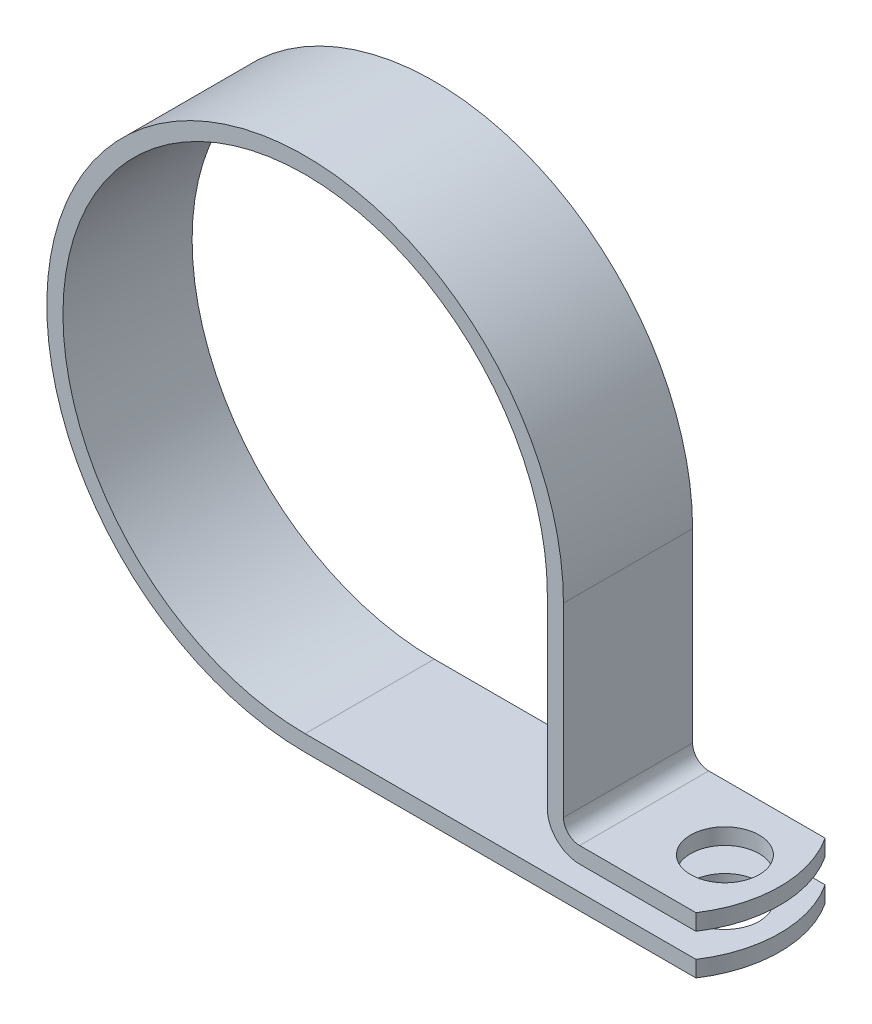
from build123d import *

# Parameters (mm, degrees)
BOSS_EXTRUDE1_DEPTH     = 6.35
SKETCH2_R               = 3.3734375
CUT_EXTRUDE1_DEPTH      = 49.087533302
CUT_EXTRUDE3_DEPTH      = 49.087533302
CUT_EXTRUDE3_DEPTH_BACK = 49.087533302


with BuildPart() as part:
    # Sketch1 → Boss-Extrude1 (new, symmetric)
    with BuildSketch(Plane.XY):
        with BuildLine():
            Line((0, -23.8125), (40.3352, -23.8125))
            Line((40.3352, -23.8125), (40.3352, -25.4))
            Line((40.3352, -25.4), (0, -25.4))
            ThreePointArc((0, -25.4), (-17.960512242, 17.960512242), (25.4, 0))
            Line((25.4, 0), (25.4, -18.2499))
            ThreePointArc((25.4, -18.2499), (25.864967985, -19.372432015), (26.9875, -19.8374))
            Line((26.9875, -19.8374), (40.3352, -19.8374))
            Line((40.3352, -19.8374), (40.3352, -21.4249))
            Line((40.3352, -21.4249), (26.9875, -21.4249))
            ThreePointArc((26.9875, -21.4249), (24.74243597, -20.49496403), (23.8125, -18.2499))
            Line((23.8125, -18.2499), (23.8125, 0))
            ThreePointArc((23.8125, 0), (-16.837980227, 16.837980227), (0, -23.8125))
        make_face()
    extrude(amount=BOSS_EXTRUDE1_DEPTH, both=True)

    # Sketch2 → Cut-Extrude1 (cut, through all)
    with BuildSketch(Plane(origin=(0, 0, 0), x_dir=(1, 0, 0), z_dir=(0, 1, 0))):
        with Locations((34.925, 0)):
            Circle(SKETCH2_R)
    extrude(amount=-CUT_EXTRUDE1_DEPTH, mode=Mode.SUBTRACT)

    # Sketch4 → Cut-Extrude3 (cut, two sides: drawn at the far end of the back side and taken through both)
    with BuildSketch(Plane(origin=(0, 0, 0), x_dir=(1, 0, 0), z_dir=(0, 1, 0)).offset(-CUT_EXTRUDE3_DEPTH_BACK)):
        with BuildLine():
            Line((-38.72359939, 123.366595742), (38.4302, 6.35))
            ThreePointArc((38.4302, 6.35), (40.3352, 0), (38.4302, -6.35))
            Line((38.4302, -6.35), (-38.72359939, -123.366595742))
            Line((-38.72359939, -123.366595742), (241.601871727, -123.366595742))
            Line((241.601871727, -123.366595742), (241.601871727, 123.366595742))
            Line((241.601871727, 123.366595742), (-38.72359939, 123.366595742))
        make_face()
    extrude(amount=CUT_EXTRUDE3_DEPTH + CUT_EXTRUDE3_DEPTH_BACK, mode=Mode.SUBTRACT)


solid = part.part
